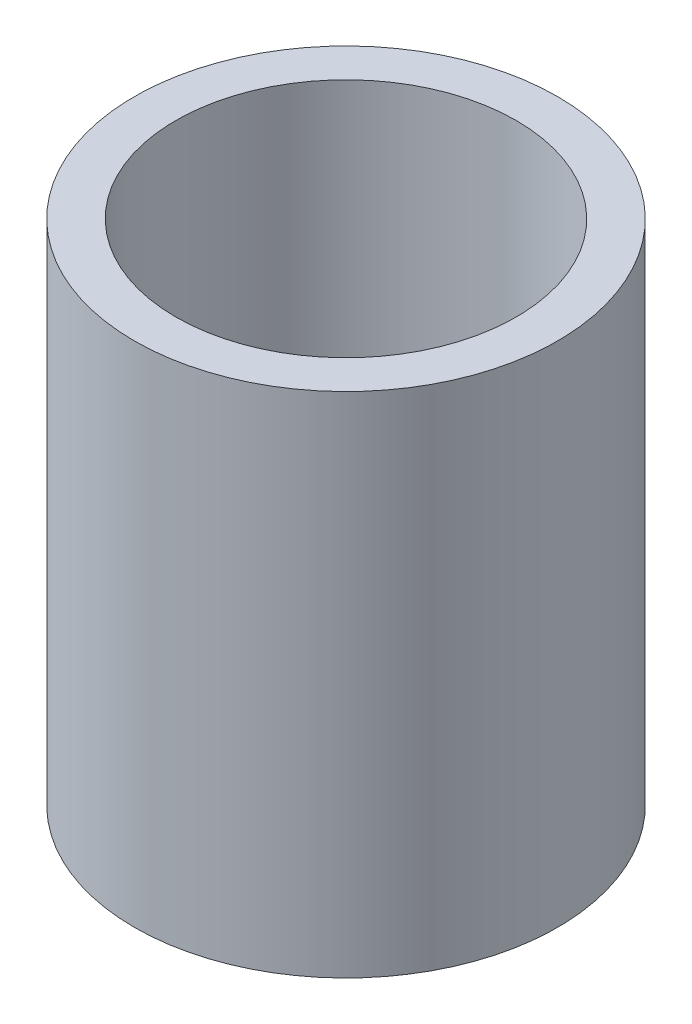
from build123d import *

# Parameters (mm, degrees)
SKETCH1_R      = 15.875
SKETCH1_R_2    = 12.76985
EXTRUDE1_DEPTH = 38.1


with BuildPart() as part:
    # Sketch1 → Extrude1 (new body)
    with BuildSketch(Plane(origin=(0, 0, 0), x_dir=(1, 0, 0), z_dir=(0, 1, 0))):
        with Locations(Location((0, 0, 0), (0, 0, 90))):
            Circle(SKETCH1_R)
        with Locations(Location((0, 0, 0), (0, 0, 90))):
            Circle(SKETCH1_R_2, mode=Mode.SUBTRACT)
    extrude(amount=EXTRUDE1_DEPTH)


solid = part.part
